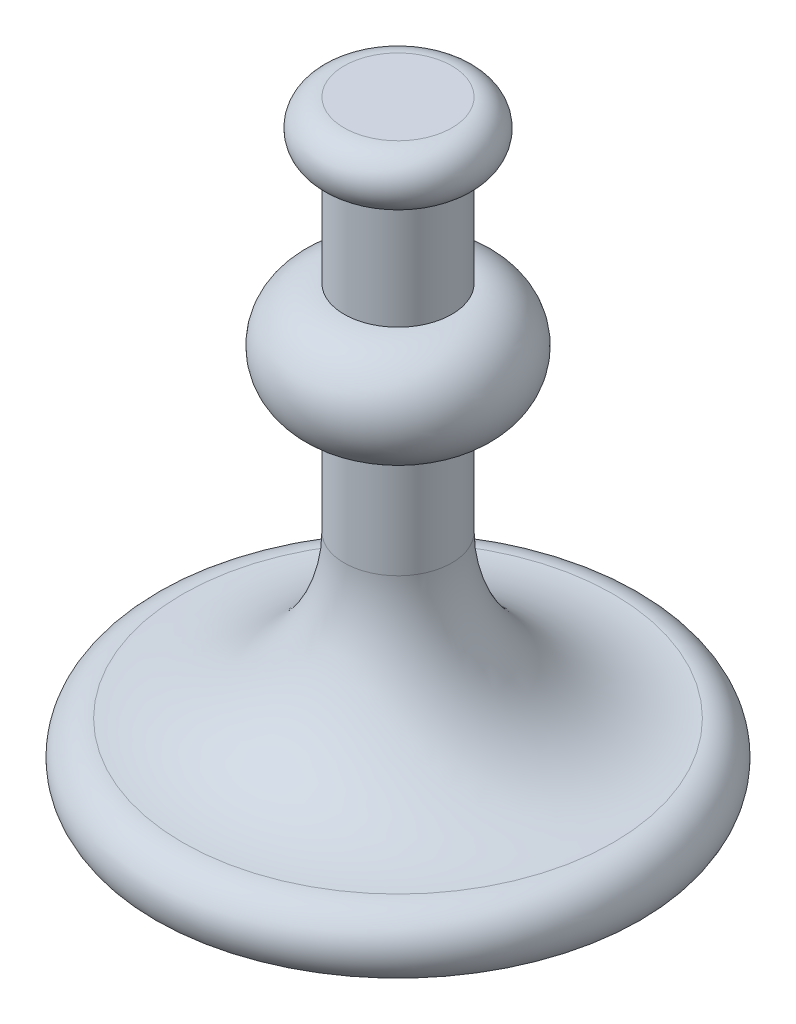
from build123d import *


with BuildPart() as part:
    # Sketch1 → Revolve1 (revolve)
    with BuildSketch(Plane.XY, mode=Mode.PRIVATE) as revolve1_sk:
        with BuildLine():
            Line((0, 0), (0, 220))
            Line((0, 220), (20, 220))
            ThreePointArc((20, 220), (30, 210), (20, 200))
            Line((20, 200), (20, 160))
            ThreePointArc((20, 160), (40, 140), (20, 120))
            Line((20, 120), (20, 80))
            ThreePointArc((20, 80), (37.573593129, 37.573593129), (80, 20))
            ThreePointArc((80, 20), (91.180339887, 13.090169944), (90, 0))
            Line((90, 0), (0, 0))
        make_face()
    revolve(revolve1_sk.sketch.rotate(Axis((0, 0, 0), (0, 1, 0)), 90), axis=Axis((0, 0, 0), (0, 1, 0)))


solid = part.part
